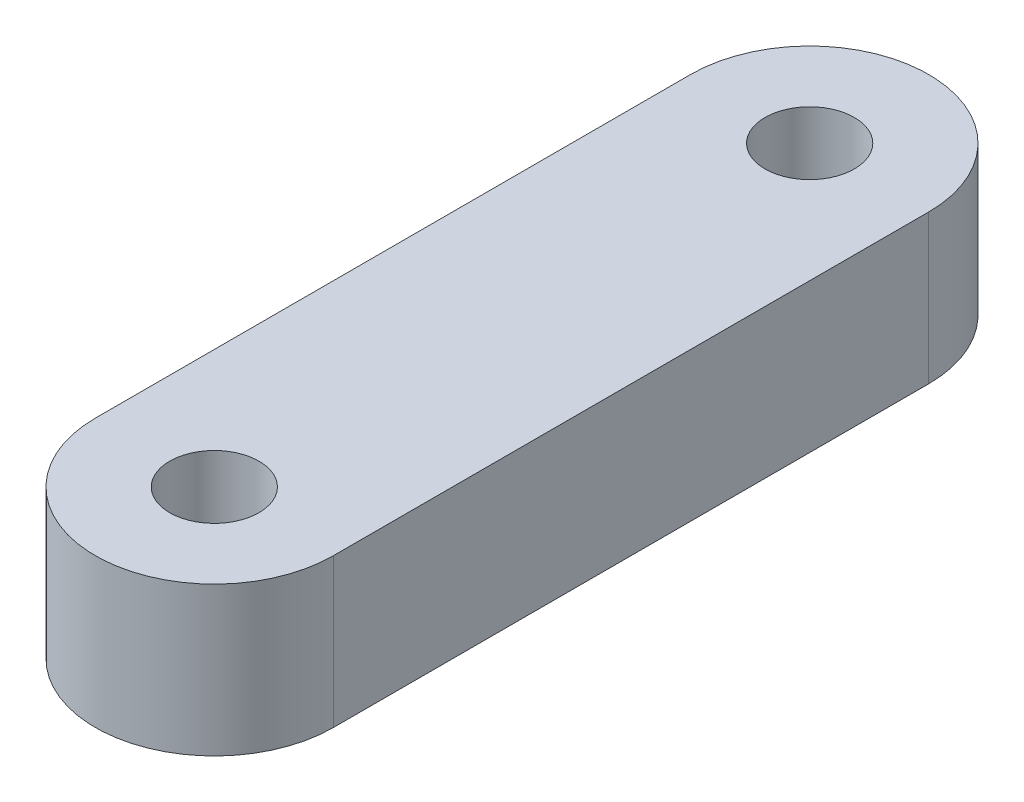
from build123d import *

# Parameters (mm, degrees)
SKETCH_1_R      = 1.5
EXTRUDE_1_DEPTH = 5


with BuildPart() as part:
    # 草图1 → 凸台-拉伸1 (new body)
    with BuildSketch(Plane(origin=(0, 0, 0), x_dir=(1, 0, 0), z_dir=(0, 1, 0))):
        with BuildLine():
            Line((4, 10), (4, -10))
            ThreePointArc((4, -10), (0, -14), (-4, -10))
            Line((-4, -10), (-4, 10))
            ThreePointArc((-4, 10), (0, 14), (4, 10))
        make_face()
        with Locations(Location((0, 10, 0), (0, 0, 270))):
            Circle(SKETCH_1_R, mode=Mode.SUBTRACT)
        with Locations(Location((0, -10, 0), (0, 0, 270))):
            Circle(SKETCH_1_R, mode=Mode.SUBTRACT)
    extrude(amount=EXTRUDE_1_DEPTH)


solid = part.part
